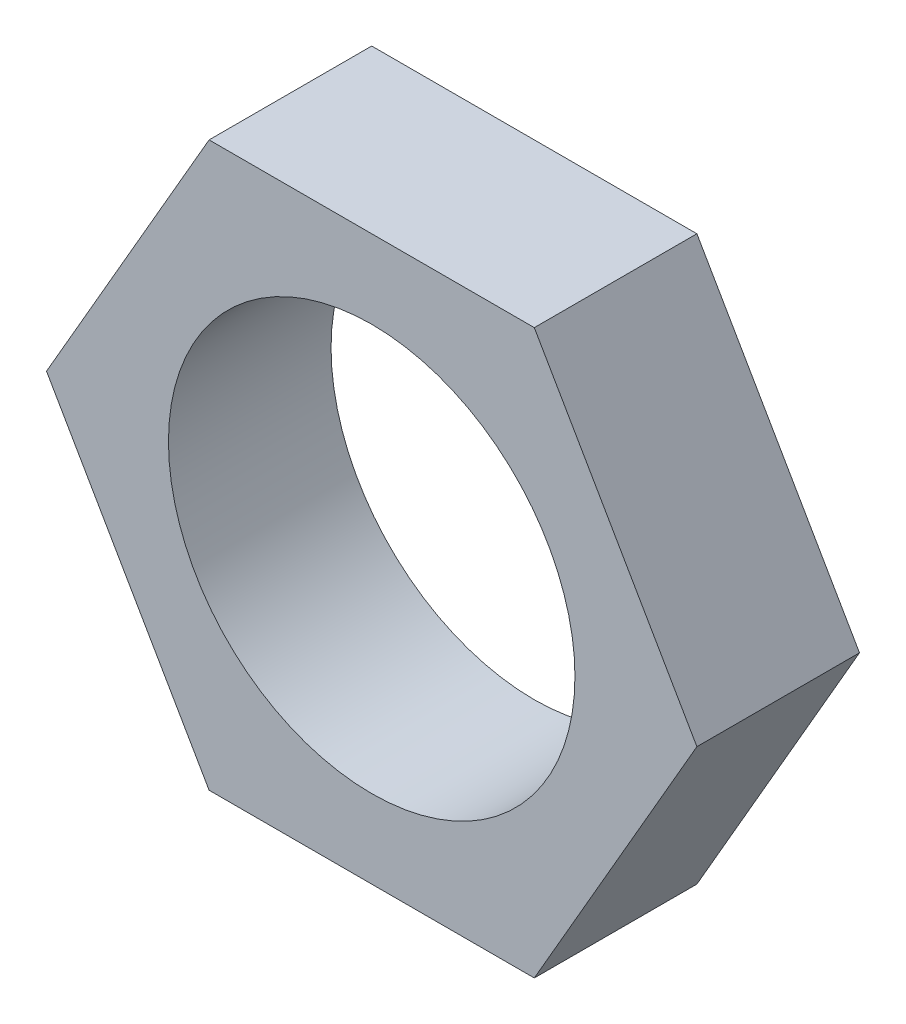
from build123d import *

# Parameters (mm, degrees)
SKETCH_1_R      = 2.5
EXTRUDE_1_DEPTH = 2


with BuildPart() as part:
    # 草图1 → 凸台-拉伸1 (new body)
    with BuildSketch(Plane.XY):
        Polygon((4, 0), (2, 3.464101615), (-2, 3.464101615), (-4, 0), (-2, -3.464101615), (2, -3.464101615), align=None)
        Circle(SKETCH_1_R, mode=Mode.SUBTRACT)
    extrude(amount=EXTRUDE_1_DEPTH)


solid = part.part
